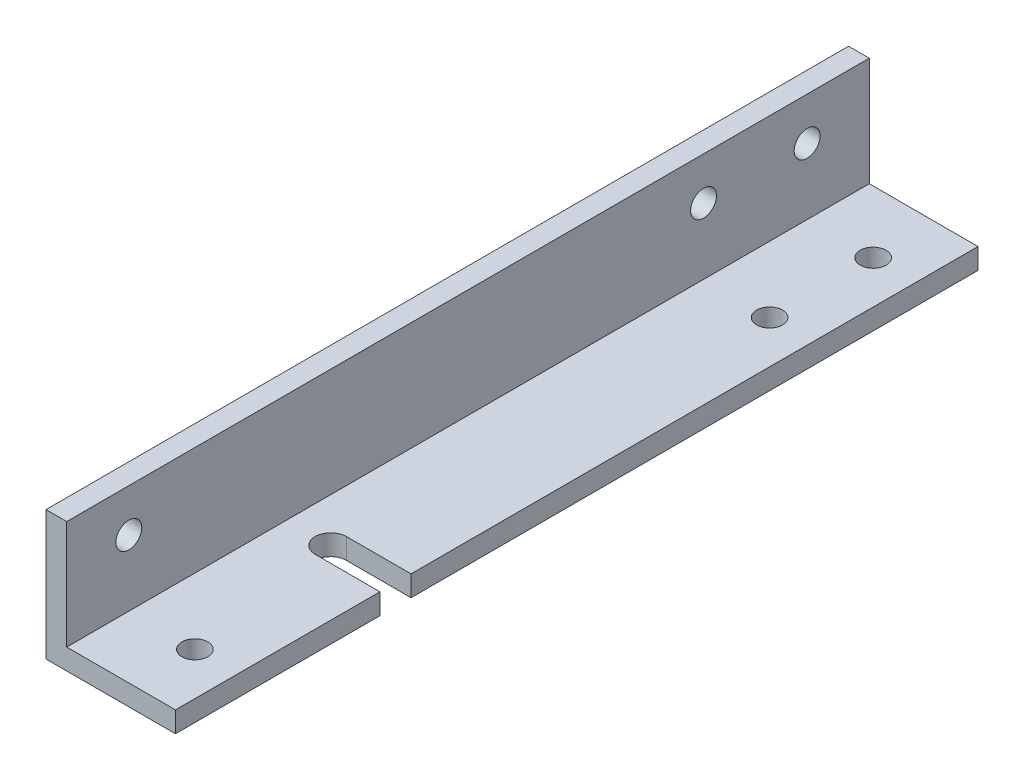
from build123d import *

# Parameters (mm, degrees)
EXTRUDE_1_DEPTH     = 155
HOLE_WIZARD_M6_1_D  = 5
HOLE_WIZARD_M6_2_D  = 5
CUT_EXTRUDE_1_DEPTH = 159.981130956


with BuildPart() as part:
    # 草图1 → 凸台-拉伸1 (new body)
    with BuildSketch(Plane.XY):
        Polygon((0, 25), (0, 0), (25, 0), (25, 4), (4, 4), (4, 25), align=None)
    extrude(amount=EXTRUDE_1_DEPTH)

    # M6 螺纹孔1 (through all)
    with Locations(Plane(origin=(0, 4, 0), x_dir=(1, 0, 0), z_dir=(0, 1, 0))):
        with Locations((16.75, -12), (16.75, -143), (16.75, -32)):
            Hole(HOLE_WIZARD_M6_1_D / 2)

    # M6 螺纹孔2 (through all)
    with Locations(Plane(origin=(4, 0, 0), x_dir=(0, 0, -1), z_dir=(1, 0, 0))):
        with Locations((-143, 16.75), (-12, 16.75), (-32, 16.75)):
            Hole(HOLE_WIZARD_M6_2_D / 2)

    # 草图6 → 切除-拉伸1 (cut, through all)
    with BuildSketch(Plane.XZ):
        with BuildLine():
            Line((25, 109.5), (12.5, 109.5))
            ThreePointArc((12.5, 109.5), (9.5, 112.5), (12.5, 115.5))
            Line((12.5, 115.5), (25, 115.5))
            ThreePointArc((25, 115.5), (28, 112.5), (25, 109.5))
        make_face()
    extrude(amount=-CUT_EXTRUDE_1_DEPTH, mode=Mode.SUBTRACT)


solid = part.part
